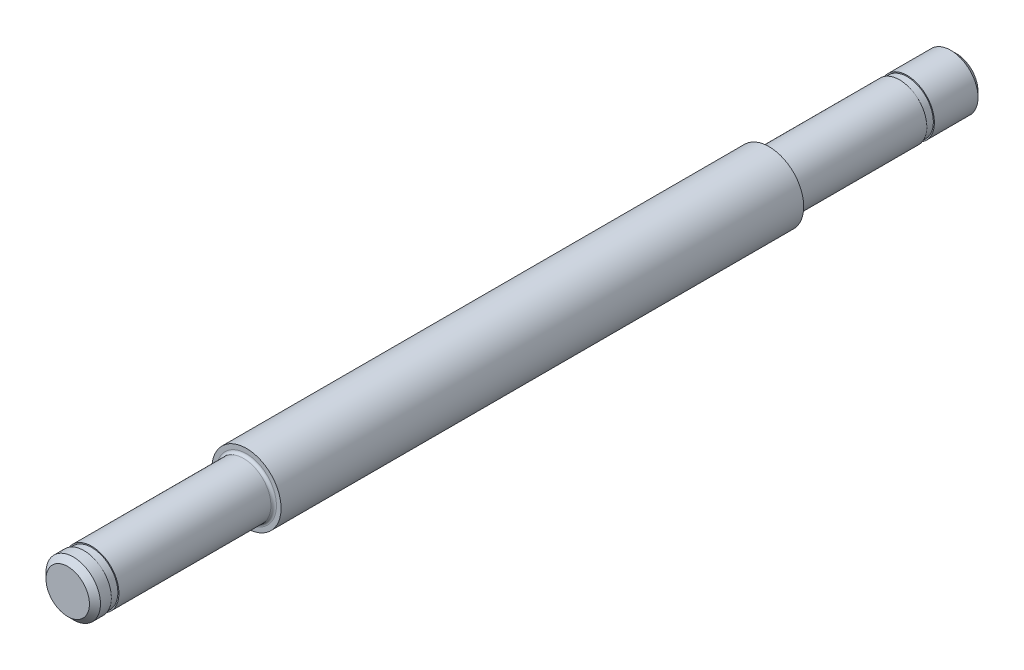
from build123d import *

# Parameters (mm, degrees)
SKETCH1_R           = 2.5
BOSS_EXTRUDE1_DEPTH = 40.767
SKETCH2_W           = 0.7
SKETCH2_H           = 0.1
SKETCH5_R           = 3.175
BOSS_EXTRUDE3_DEPTH = 47.9552
SKETCH7_W           = 0.7
SKETCH7_H           = 0.1
CHAMFER1_SIZE       = 0.508
FILLET1_R           = 0.254


with BuildPart() as part:
    # Sketch1 → Boss-Extrude1 (new, symmetric)
    with BuildSketch(Plane.XY):
        with Locations(Location((0, 0, 0), (0, 0, 180))):
            Circle(SKETCH1_R)
    extrude(amount=BOSS_EXTRUDE1_DEPTH, both=True)

    # Sketch2 → Cut-Revolve1 (revolve, cut)
    with BuildSketch(Plane(origin=(0, 0, 0), x_dir=(0, 0, -1), z_dir=(1, 0, 0)), mode=Mode.PRIVATE) as cut_revolve1_sk:
        with Locations((-38.914555436, 2.45)):
            Rectangle(SKETCH2_W, SKETCH2_H)
    revolve(cut_revolve1_sk.sketch.rotate(Axis((0, 0, 40.767), (0, 0, -1)), 270), axis=Axis((0, 0, 40.767), (0, 0, -1)), mode=Mode.SUBTRACT)

    # Sketch5 → Boss-Extrude3 (add)
    with BuildSketch(Plane(origin=(0, 0, 24.364555436), x_dir=(-1, 0, 0), z_dir=(0, 0, -1))):
        with Locations(Location((0, 0, 0), (0, 0, 180))):
            Circle(SKETCH5_R)
    extrude(amount=BOSS_EXTRUDE3_DEPTH)

    # Sketch7 → Cut-Revolve2 (revolve, cut)
    with BuildSketch(Plane(origin=(0, -92.71594082, 0), x_dir=(0, 0, 1), z_dir=(1, 0, 0)), mode=Mode.PRIVATE) as cut_revolve2_sk:
        with Locations((-35.912002714, -95.16594082)):
            Rectangle(SKETCH7_W, SKETCH7_H)
    revolve(cut_revolve2_sk.sketch.rotate(Axis((0, 0, -23.590644564), (0, 0, -1)), 270), axis=Axis((0, 0, -23.590644564), (0, 0, -1)), mode=Mode.SUBTRACT)

    # Chamfer1
    chamfer1_edges = [part.edges().sort_by_distance(p)[0] for p in [
        (2.5, 0, -40.767),
        (2.5, 0, 40.767),
    ]]
    chamfer(chamfer1_edges, length=CHAMFER1_SIZE)

    # Fillet1
    fillet1_edges = [part.edges().sort_by_distance(p)[0] for p in [
        (2.5, 0, 24.364555436),
        (2.5, 0, -23.590644564),
    ]]
    fillet(fillet1_edges, radius=FILLET1_R)


solid = part.part
